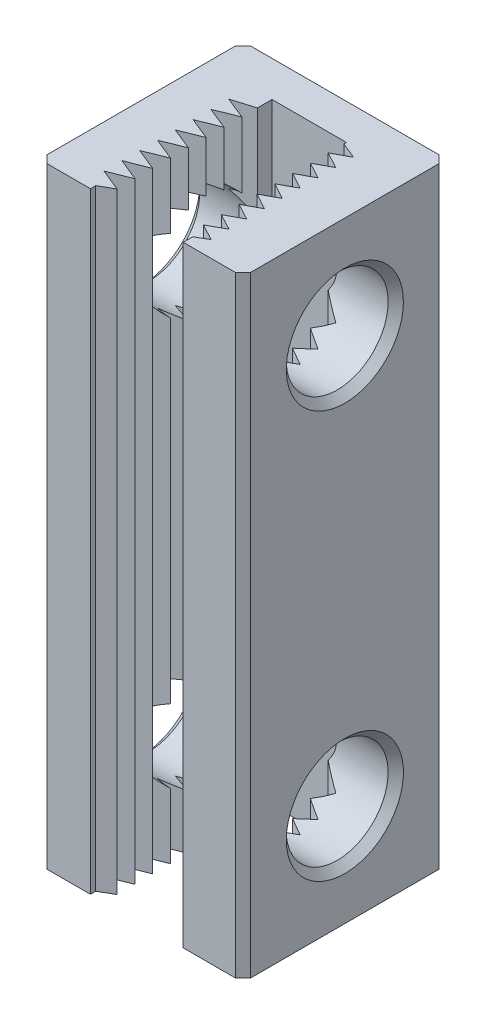
from build123d import *

# Parameters (mm, degrees)
SKETCH1_W                  = 8
SKETCH1_H                  = 8
BOSS_EXTRUDE1_DEPTH        = 300
CUT_EXTRUDE1_DEPTH         = 301.213257535
SKETCH3_R                  = 2
CUT_EXTRUDE2_DEPTH         = 301.213257535
CHAMFER1_SIZE              = 0.3
CHAMFER2_SIZE              = 0.3
LPATTERN1_COUNT            = 19
LPATTERN1_PITCH            = 16
CHAMFER1_OF_LPATTERN1_SIZE = 0.3
SKETCH4_W                  = 8
SKETCH4_H                  = 276
CUT_EXTRUDE3_DEPTH         = 301.213257535


with BuildPart() as part:
    # Sketch1 → Boss-Extrude1 (new body)
    with BuildSketch(Plane(origin=(0, 0, 0), x_dir=(1, 0, 0), z_dir=(0, 1, 0))):
        with Locations((4, 4)):
            Rectangle(SKETCH1_W, SKETCH1_H)
    extrude(amount=BOSS_EXTRUDE1_DEPTH)

    # Sketch2 → Cut-Extrude1 (cut, through all)
    with BuildSketch(Plane.XZ):
        Polygon((5.652029979, 0), (2.008445554, 0), (2.008445554, -0.208206305), (2.54, -0.515099407), (1.673719601, -0.865099407), (2.54, -1.215099407), (1.673719601, -1.572712655), (2.54, -1.915099407), (1.673719601, -2.265099407), (2.54, -2.615099407), (1.673719601, -2.965099407), (2.54, -3.315099407), (1.673719601, -3.665099407), (2.54, -4.015099407), (1.673719601, -4.365099407), (2.54, -4.715099407), (1.673719601, -5.065099407), (2.54, -5.415099407), (1.673719601, -5.765099407), (2.54, -6.026380467), (2.54, -6.6), (5.46, -6.6), (5.46, -6.49878106), (6.106693316, -6.2375), (5.46, -5.8875), (6.106693316, -5.5375), (5.46, -5.1875), (6.106693316, -4.8375), (5.46, -4.4875), (6.106693316, -4.1375), (5.46, -3.7875), (6.106693316, -3.4375), (5.46, -3.0875), (6.106693316, -2.7375), (5.46, -2.3875), (6.106693316, -2.0375), (5.46, -1.6875), (6.106693316, -1.345113247), (5.46, -0.9875), (6.106693316, -0.6375), (5.652029979, -0.375), align=None)
    extrude(amount=-CUT_EXTRUDE1_DEPTH, mode=Mode.SUBTRACT)

    # Sketch3 → Cut-Extrude2 (cut, through all)
    with BuildSketch(Plane(origin=(8, 0, 0), x_dir=(0, 0, -1), z_dir=(1, 0, 0))):
        with Locations((4, 4)):
            Circle(SKETCH3_R)
    cut_extrude2 = extrude(amount=-CUT_EXTRUDE2_DEPTH, mode=Mode.SUBTRACT)

    # Chamfer1
    chamfer1_edges = [part.edges().sort_by_distance(p)[0] for p in [
        (0, 4, -2),
        (8, 4, -2),
    ]]
    chamfer(chamfer1_edges, length=CHAMFER1_SIZE)

    # Chamfer2
    chamfer2_edges = [part.edges().sort_by_distance(p)[0] for p in [
        (0, 150, -8),
        (8, 150, -8),
        (8, 150, 0),
        (0, 150, 0),
    ]]
    chamfer(chamfer2_edges, length=CHAMFER2_SIZE)

    # LPattern1: Cut-Extrude2 ×19
    with Locations(*[(0, i * LPATTERN1_PITCH, 0) for i in range(1, LPATTERN1_COUNT)]):
        add(cut_extrude2, mode=Mode.SUBTRACT)

    # Chamfer1 of LPattern1
    chamfer1_of_lpattern1_edges = [part.edges().sort_by_distance(p)[0] for p in [
        (0, 20, -2),
        (8, 20, -2),
        (0, 36, -2),
        (8, 36, -2),
        (0, 52, -2),
        (8, 52, -2),
        (0, 68, -2),
        (8, 68, -2),
        (0, 84, -2),
        (8, 84, -2),
        (0, 100, -2),
        (8, 100, -2),
        (0, 116, -2),
        (8, 116, -2),
        (0, 132, -2),
        (8, 132, -2),
        (0, 148, -2),
        (8, 148, -2),
        (0, 164, -2),
        (8, 164, -2),
        (0, 180, -2),
        (8, 180, -2),
        (0, 196, -2),
        (8, 196, -2),
        (0, 212, -2),
        (8, 212, -2),
        (0, 228, -2),
        (8, 228, -2),
        (0, 244, -2),
        (8, 244, -2),
        (0, 260, -2),
        (8, 260, -2),
        (0, 276, -2),
        (8, 276, -2),
        (0, 292, -2),
        (8, 292, -2),
    ]]
    chamfer(chamfer1_of_lpattern1_edges, length=CHAMFER1_OF_LPATTERN1_SIZE)

    # Sketch4 → Cut-Extrude3 (cut, through all)
    with BuildSketch(Plane(origin=(8, 0, 0), x_dir=(0, 0, -1), z_dir=(1, 0, 0))):
        with Locations((4, 162)):
            Rectangle(SKETCH4_W, SKETCH4_H)
    extrude(amount=-CUT_EXTRUDE3_DEPTH, mode=Mode.SUBTRACT)


solid = part.part
